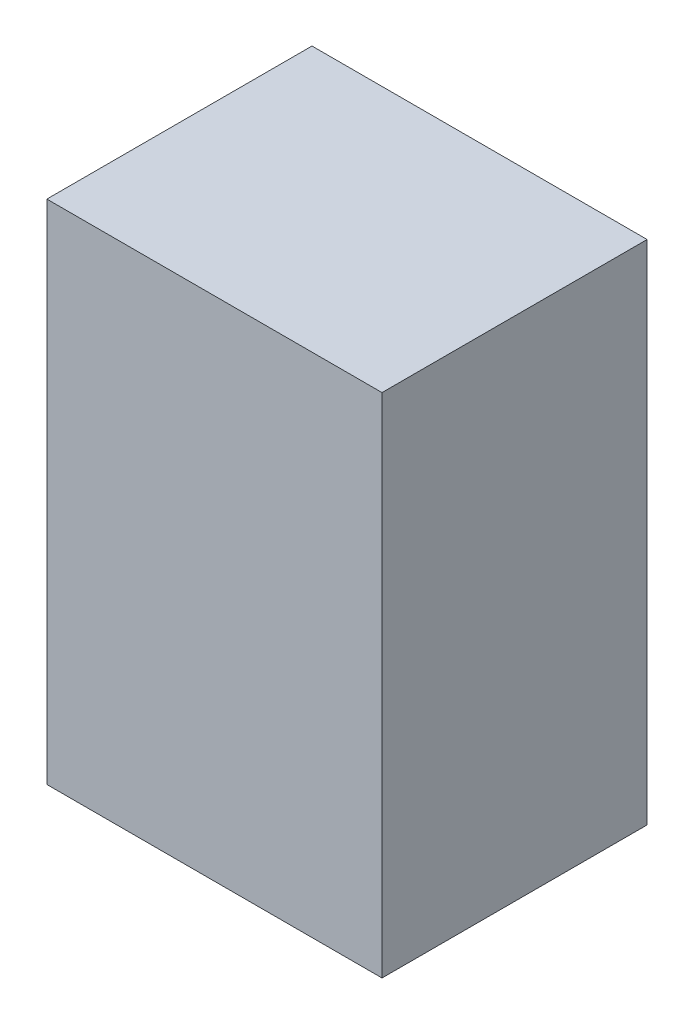
from build123d import *

# Parameters (mm, degrees)
SKETCH_1_W      = 66.105046808
SKETCH_1_H      = 52.292051952
EXTRUDE_1_DEPTH = 100


with BuildPart() as part:
    # 草图1 → 凸台-拉伸1 (new body)
    with BuildSketch(Plane(origin=(0, 0, 0), x_dir=(1, 0, 0), z_dir=(0, 1, 0))):
        with Locations((-22.857217677, 20.061730623)):
            Rectangle(SKETCH_1_W, SKETCH_1_H)
    extrude(amount=EXTRUDE_1_DEPTH)


solid = part.part
